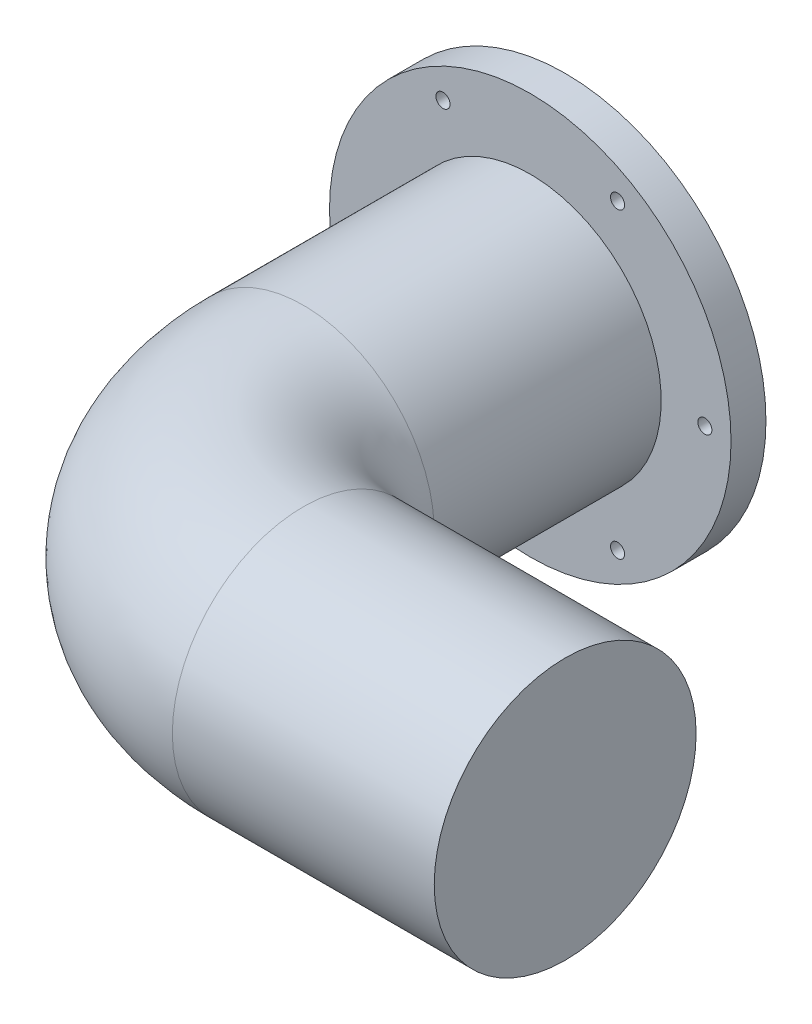
from build123d import *

# Parameters (mm, degrees)
SWEEP1_PROFILE_R               = 37.5
SKETCH3_R                      = 57.5
BOSS_EXTRUDE1_DEPTH            = 10
TAP_DRILL_FOR_10_32_TAP1_D     = 4.0386
TAP_DRILL_FOR_10_32_TAP1_DEPTH = 10
SKETCH11_R                     = 7
CUT_EXTRUDE1_DEPTH             = 5


with BuildPart() as part:
    # Sweep1: sweep along a path in Sketch1
    with BuildLine(Plane(origin=(0, 0, 0), x_dir=(1, 0, 0), z_dir=(0, 1, 0))) as sweep1_path:
        Line((0, 0), (-75, 0))
        ThreePointArc((-75, 0), (-110.355339059, 14.644660941), (-125, 50))
        Line((-125, 50), (-125, 125))
    # Sweep1 profile (on start of the path) → Sweep1 (sweep)
    with BuildSketch(Plane(origin=(0, 0, 0), x_dir=(0, 0, -1), z_dir=(-1, 0, 0))):
        Circle(SWEEP1_PROFILE_R)
    sweep(path=sweep1_path.line)

    # Sketch3 → Boss-Extrude1 (add)
    with BuildSketch(Plane(origin=(0, 0, -125), x_dir=(-1, 0, 0), z_dir=(0, 0, -1))):
        with Locations((125, 0)):
            Circle(SKETCH3_R)
    extrude(amount=-BOSS_EXTRUDE1_DEPTH)

    # Tap Drill for #10-32 Tap1
    with Locations(Plane.XY.offset(-115)):
        with Locations((-150, 43.301270189), (-175, 0), (-150, -43.301270189), (-100, -43.301270189), (-75, 0), (-100, 43.301270189)):
            Hole(TAP_DRILL_FOR_10_32_TAP1_D / 2, depth=TAP_DRILL_FOR_10_32_TAP1_DEPTH)

    # Sketch11 → Cut-Extrude1 (cut)
    with BuildSketch(Plane(origin=(0, 0, -125), x_dir=(-1, 0, 0), z_dir=(0, 0, -1))):
        with Locations((152.5, 0)):
            Circle(SKETCH11_R)
        with Locations((134.166005189, 25.927482502)):
            Circle(SKETCH11_R)
        with Locations((107.909337503, 21.544355535)):
            Circle(SKETCH11_R)
        with Locations((97.667030752, -3.026349633)):
            Circle(SKETCH11_R)
        with Locations((113.036372178, -24.761292562)):
            Circle(SKETCH11_R)
        with Locations((139.61592, -23.29431009)):
            Circle(SKETCH11_R)
    extrude(amount=-CUT_EXTRUDE1_DEPTH, mode=Mode.SUBTRACT)


solid = part.part
